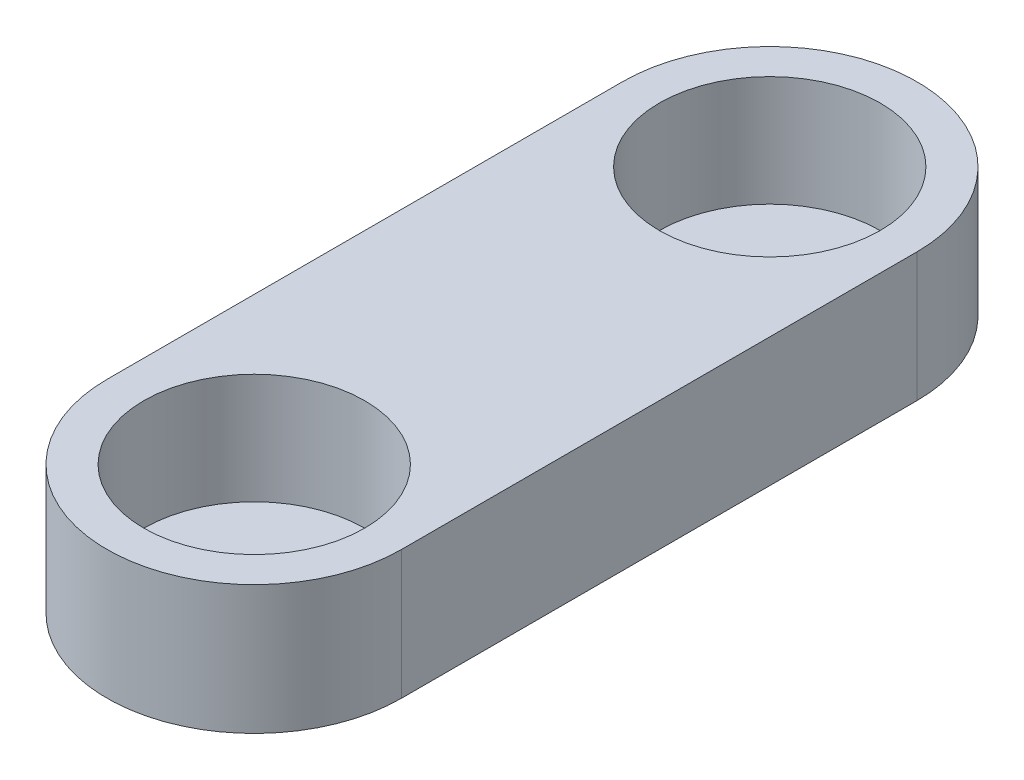
from build123d import *

# Parameters (mm, degrees)
SKETCH1_R           = 3
BOSS_EXTRUDE1_DEPTH = 3
BOSS_EXTRUDE2_START = 0.5
BOSS_EXTRUDE2_DEPTH = 0.5
SKETCH3_R           = 0.75
CUT_EXTRUDE1_DEPTH  = 2.5


with BuildPart() as part:
    # Sketch1 → Boss-Extrude1 (new body)
    with BuildSketch(Plane(origin=(0, 0, 0), x_dir=(1, 0, 0), z_dir=(0, 1, 0))):
        with BuildLine():
            Line((4, 7), (4, -7))
            ThreePointArc((4, -7), (0, -11), (-4, -7))
            Line((-4, -7), (-4, 7))
            ThreePointArc((-4, 7), (0, 11), (4, 7))
        make_face()
        with Locations(Location((0, 7, 0), (0, 0, 270))):
            Circle(SKETCH1_R, mode=Mode.SUBTRACT)
        with Locations(Location((0, -7, 0), (0, 0, 270))):
            Circle(SKETCH1_R, mode=Mode.SUBTRACT)
    extrude(amount=BOSS_EXTRUDE1_DEPTH)

    # Sketch2 → Boss-Extrude2 (add)
    with BuildSketch(Plane.XZ.offset(BOSS_EXTRUDE2_START)):
        with BuildLine():
            Line((4, 7), (4, -7))
            ThreePointArc((4, -7), (0, -11), (-4, -7))
            Line((-4, -7), (-4, 7))
            ThreePointArc((-4, 7), (0, 11), (4, 7))
        make_face()
    extrude(amount=-BOSS_EXTRUDE2_DEPTH)

    # Sketch3 → Cut-Extrude1 (cut)
    with BuildSketch(Plane.XZ.offset(0.5)):
        with Locations(Location((0, 0, 0), (0, 0, 270))):
            Circle(SKETCH3_R)
    extrude(amount=-CUT_EXTRUDE1_DEPTH, mode=Mode.SUBTRACT)


solid = part.part
